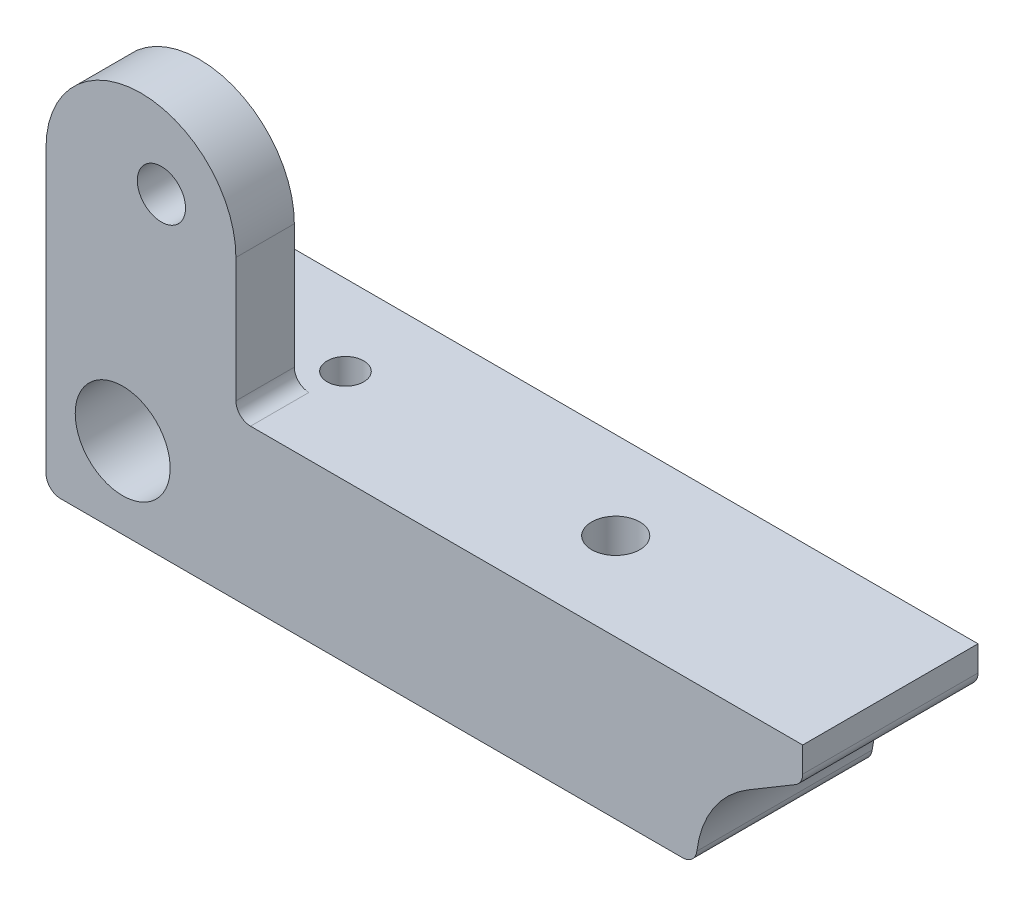
from build123d import *

# Parameters (mm, degrees)
SKETCH1_W           = 51.8
SKETCH1_H           = 10.8
BOSS_EXTRUDE1_DEPTH = 12
BOSS_EXTRUDE2_DEPTH = 4
CUT_EXTRUDE1_DEPTH  = 36.675902231
FILLET1_R           = 1
SKETCH4_R           = 3.25
CUT_EXTRUDE2_DEPTH  = 36.675902231
SKETCH5_R           = 4
CUT_EXTRUDE3_DEPTH  = 1.05
M4_TAPPED_HOLE1_D   = 3.3
SKETCH8_R           = 1.25
CUT_EXTRUDE4_DEPTH  = 33.723233337
M4_TAPPED_HOLE2_D   = 3.3


with BuildPart() as part:
    # Sketch1 → Boss-Extrude1 (new body)
    with BuildSketch(Plane.XY):
        Rectangle(SKETCH1_W, SKETCH1_H)
    extrude(amount=BOSS_EXTRUDE1_DEPTH)

    # Sketch2 → Boss-Extrude2 (add)
    with BuildSketch(Plane.XY.offset(12)):
        with BuildLine():
            Line((-25.9, 14.9), (-25.9, 5.4))
            Line((-25.9, 5.4), (-12.9, 5.4))
            Line((-12.9, 5.4), (-12.9, 14.9))
            ThreePointArc((-12.9, 14.9), (-19.4, 21.4), (-25.9, 14.9))
        make_face()
    extrude(amount=-BOSS_EXTRUDE2_DEPTH)

    # Sketch3 → Cut-Extrude1 (cut, through all)
    with BuildSketch(Plane(origin=(0, 0, 0), x_dir=(-1, 0, 0), z_dir=(0, 0, -1))):
        with BuildLine():
            Line((-22.160417654, 0.869411765), (-25.9, 3.1))
            Line((-25.9, 3.1), (-25.9, -5.4))
            Line((-25.9, -5.4), (-18.6, -5.4))
            ThreePointArc((-18.6, -5.4), (-19.552207032, -1.795069427), (-22.160417654, 0.869411765))
        make_face()
    extrude(amount=-CUT_EXTRUDE1_DEPTH, mode=Mode.SUBTRACT)

    # Fillet1
    fillet1_edges = [part.edges().sort_by_distance(p)[0] for p in [
        (-25.9, 5.4, 4),
        (-12.9, 5.4, 10),
        (18.6, -5.4, 6),
        (25.9, 3.1, 6),
        (-25.9, -5.4, 6),
    ]]
    fillet(fillet1_edges, radius=FILLET1_R)

    # Sketch4 → Cut-Extrude2 (cut, through all)
    with BuildSketch(Plane(origin=(0, 0, 0), x_dir=(-1, 0, 0), z_dir=(0, 0, -1))):
        with Locations((20.65, 0.15)):
            Circle(SKETCH4_R)
    extrude(amount=-CUT_EXTRUDE2_DEPTH, mode=Mode.SUBTRACT)

    # Sketch5 → Cut-Extrude3 (cut)
    with BuildSketch(Plane(origin=(0, 0, 0), x_dir=(-1, 0, 0), z_dir=(0, 0, -1))):
        with Locations((20.65, 0.15)):
            Circle(SKETCH5_R)
    extrude(amount=-CUT_EXTRUDE3_DEPTH, mode=Mode.SUBTRACT)

    # M4 Tapped Hole1 (through all)
    with Locations(Plane(origin=(0, 5.4, 0), x_dir=(1, 0, 0), z_dir=(0, 1, 0))):
        with Locations((7.1, -6)):
            Hole(M4_TAPPED_HOLE1_D / 2)

    # Sketch8 → Cut-Extrude4 (cut, through all)
    with BuildSketch(Plane(origin=(0, 5.4, 0), x_dir=(1, 0, 0), z_dir=(0, 1, 0))):
        with Locations(Location((-11.9, -5.5, 0), (0, 0, 270))):
            Circle(SKETCH8_R)
    extrude(amount=-CUT_EXTRUDE4_DEPTH, mode=Mode.SUBTRACT)

    # M4 Tapped Hole2 (through all)
    with Locations(Plane.XY.offset(12)):
        with Locations((-18, 16.1)):
            Hole(M4_TAPPED_HOLE2_D / 2)


solid = part.part
